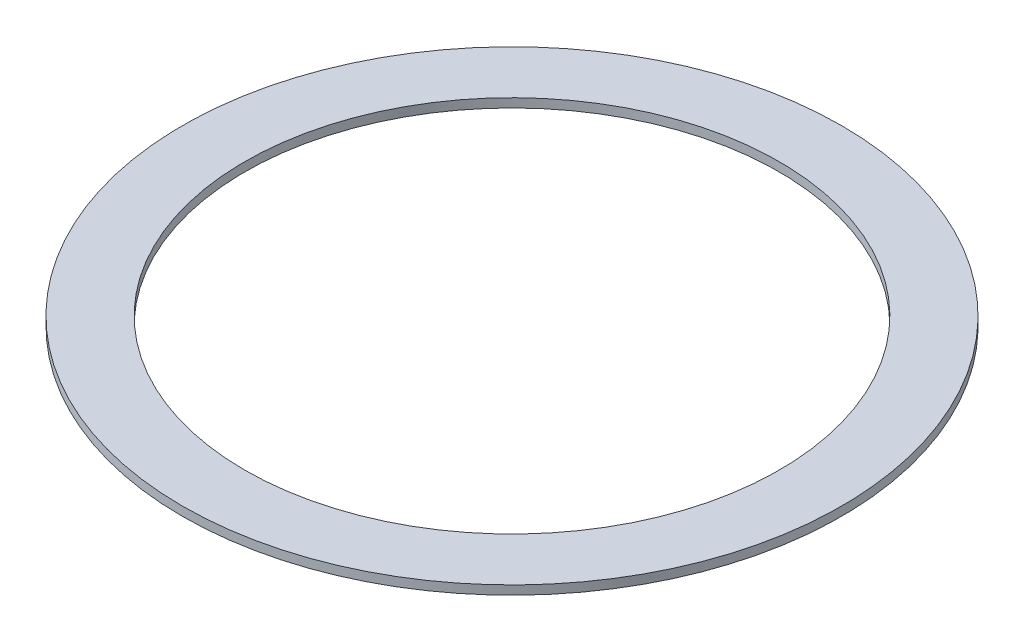
from build123d import *

# Parameters (mm, degrees)
SKETCH1_R           = 74
SKETCH1_R_2         = 60
BOSS_EXTRUDE1_DEPTH = 2


with BuildPart() as part:
    # Sketch1 → Boss-Extrude1 (new body)
    with BuildSketch(Plane(origin=(0, 0, 0), x_dir=(1, 0, 0), z_dir=(0, 1, 0))):
        with Locations(Location((0, 0, 0), (0, 0, 270))):
            Circle(SKETCH1_R)
        with Locations(Location((0, 0, 0), (0, 0, 270))):
            Circle(SKETCH1_R_2, mode=Mode.SUBTRACT)
    extrude(amount=BOSS_EXTRUDE1_DEPTH)


solid = part.part
